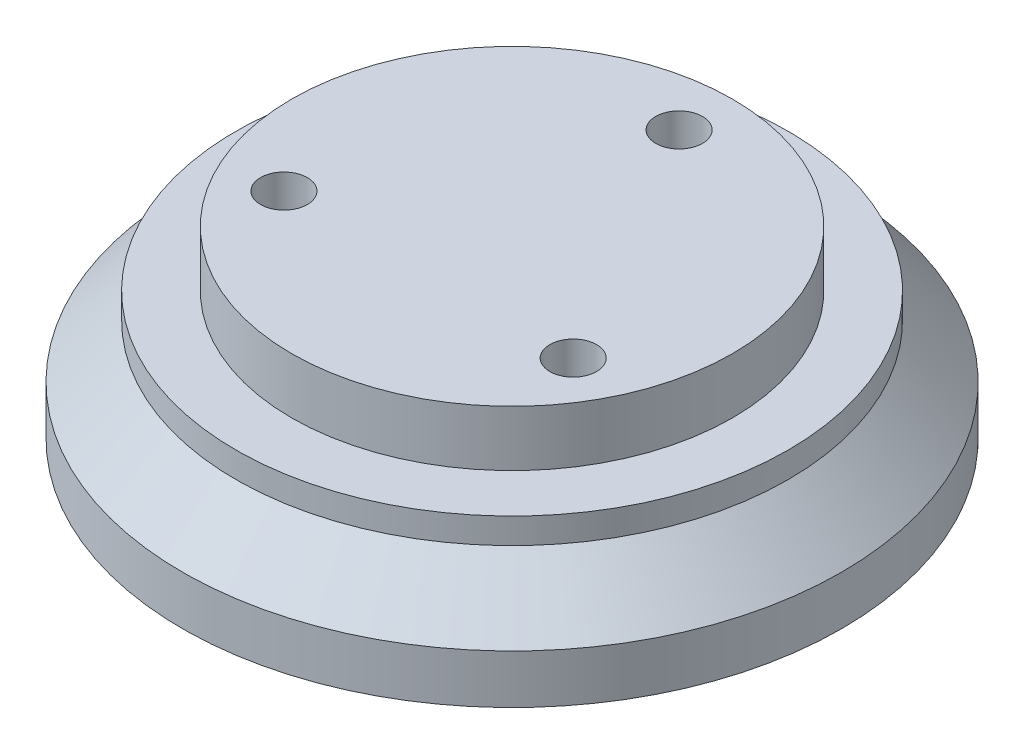
from build123d import *

# Parameters (mm, degrees)
CUT_EXTRUDE1_REACH = 46.995
SKETCH2_R          = 2.1
CUT_EXTRUDE2_DEPTH = 5


with BuildPart() as part:
    # Sketch1 → Revolve1 (revolve)
    with BuildSketch(Plane.XY):
        Polygon((0, 16.5), (19.8, 16.5), (19.8, 11.5), (24.8, 11.5), (24.8, 9.2), (29.6, 4.4), (29.6, 0), (0, 0), align=None)
    revolve(axis=Axis((0, 0, 0), (0, 1, 0)))

    # Sketch2 → Cut-Extrude1 (cut, up to next)
    with BuildSketch(Plane(origin=(0, 16.5, 0), x_dir=(1, 0, 0), z_dir=(0, 1, 0)), mode=Mode.PRIVATE) as cut_extrude1_sk1:
        with Locations(Location((0, 15, 0), (0, 0, 270))):
            Circle(SKETCH2_R)
    cut_extrude1_tool1 = extrude(cut_extrude1_sk1.sketch, amount=-CUT_EXTRUDE1_REACH, mode=Mode.PRIVATE) & part.part
    # Sketch2 → Cut-Extrude1 (cut, up to next)
    with BuildSketch(Plane(origin=(0, 16.5, 0), x_dir=(1, 0, 0), z_dir=(0, 1, 0)), mode=Mode.PRIVATE) as cut_extrude1_sk2:
        with Locations(Location((-12.990381057, -7.5, 0), (0, 0, 270))):
            Circle(SKETCH2_R)
    cut_extrude1_tool2 = extrude(cut_extrude1_sk2.sketch, amount=-CUT_EXTRUDE1_REACH, mode=Mode.PRIVATE) & part.part
    # Sketch2 → Cut-Extrude1 (cut, up to next)
    with BuildSketch(Plane(origin=(0, 16.5, 0), x_dir=(1, 0, 0), z_dir=(0, 1, 0)), mode=Mode.PRIVATE) as cut_extrude1_sk3:
        with Locations(Location((12.990381057, -7.5, 0), (0, 0, 270))):
            Circle(SKETCH2_R)
    cut_extrude1_tool3 = extrude(cut_extrude1_sk3.sketch, amount=-CUT_EXTRUDE1_REACH, mode=Mode.PRIVATE) & part.part
    add(cut_extrude1_tool1.solids().sort_by_distance((0, 16.5, -15))[0], mode=Mode.SUBTRACT)
    add(cut_extrude1_tool2.solids().sort_by_distance((-12.990381, 16.5, 7.5))[0], mode=Mode.SUBTRACT)
    add(cut_extrude1_tool3.solids().sort_by_distance((12.990381, 16.5, 7.5))[0], mode=Mode.SUBTRACT)

    # Sketch3 → Cut-Extrude2 (cut)
    with BuildSketch(Plane.XZ):
        Polygon((-10.854185061, 11.2), (-15.126577053, 11.2), (-17.262773049, 7.5), (-15.126577053, 3.8), (-10.854185061, 3.8), (-8.717989065, 7.5), align=None)
        Polygon((15.126577053, 11.2), (10.854185061, 11.2), (8.717989065, 7.5), (10.854185061, 3.8), (15.126577053, 3.8), (17.262773049, 7.5), align=None)
        Polygon((2.136195996, -11.3), (-2.136195996, -11.3), (-4.272391992, -15), (-2.136195996, -18.7), (2.136195996, -18.7), (4.272391992, -15), align=None)
    extrude(amount=-CUT_EXTRUDE2_DEPTH, mode=Mode.SUBTRACT)


solid = part.part
